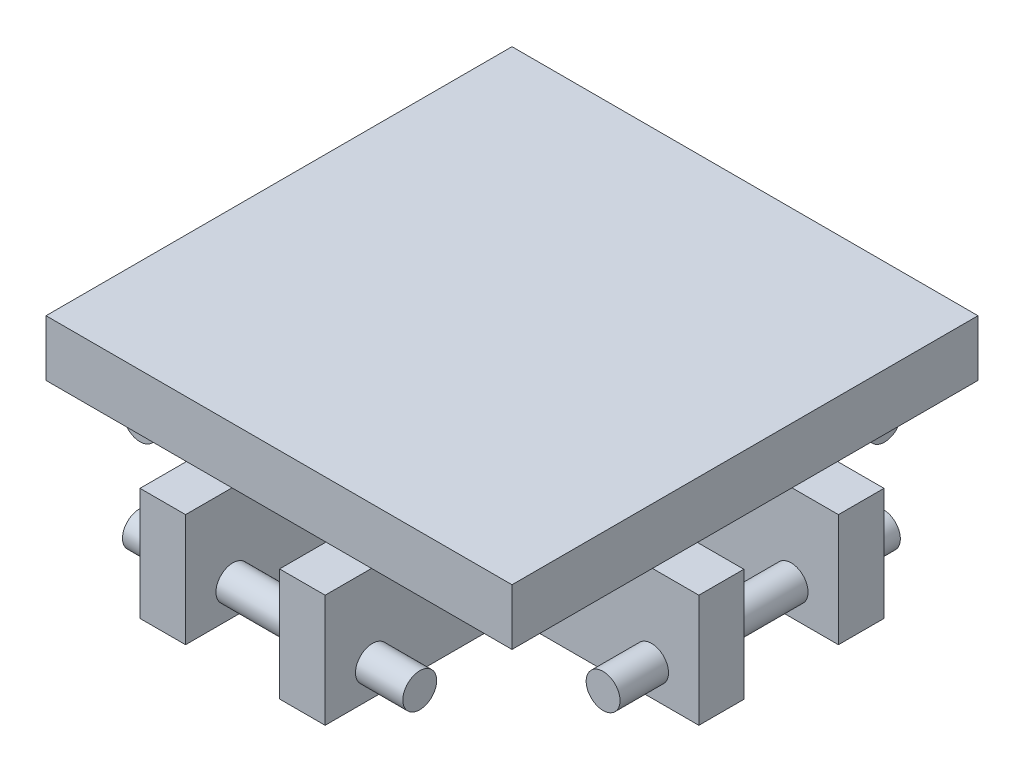
from build123d import *

# Parameters (mm, degrees)
SKETCH1_W                = 79.8
SKETCH1_H                = 79.8
BOSS_EXTRUDE1_DEPTH      = 9.6
SKETCH3_W                = 93.857769302
SKETCH3_H                = 7.7
SKETCH3_W_2              = 31.7
SKETCH3_H_2              = 31.7
SKETCH3_W_3              = 95.7
SKETCH3_H_3              = 7.8
SKETCH3_W_4              = 7.8
SKETCH3_H_4              = 95.7
BOSS_EXTRUDE2_DEPTH      = 19.3
BOSS_EXTRUDE3_DEPTH      = 32
BOSS_EXTRUDE3_DEPTH_BACK = 16
SKETCH4_R                = 2.9
BOSS_EXTRUDE4_DEPTH      = 32
BOSS_EXTRUDE4_DEPTH_BACK = 16
SKETCH5_R                = 2.9
BOSS_EXTRUDE5_DEPTH      = 32
BOSS_EXTRUDE5_DEPTH_BACK = 16
SKETCH6_R                = 2.9
BOSS_EXTRUDE6_DEPTH      = 32
BOSS_EXTRUDE6_DEPTH_BACK = 16
SKETCH7_R                = 2.9


with BuildPart() as part:
    # Sketch1 → Boss-Extrude1 (new body)
    with BuildSketch(Plane(origin=(0, 0, 0), x_dir=(1, 0, 0), z_dir=(0, 1, 0))):
        with Locations((-0.532, -4.965333333)):
            Rectangle(SKETCH1_W, SKETCH1_H)
    extrude(amount=BOSS_EXTRUDE1_DEPTH)

    # Sketch3 → Boss-Extrude2 (add)
    with BuildSketch(Plane.XZ):
        with Locations((0.389115349, 16.965333333)):
            Rectangle(SKETCH3_W, SKETCH3_H)
        with Locations((-0.532, 4.965333333)):
            Rectangle(SKETCH3_W_2, SKETCH3_H_2)
        with Locations((-0.532, -6.984666667)):
            Rectangle(SKETCH3_W_3, SKETCH3_H_3)
        with Locations((-12.482, 4.965333333)):
            Rectangle(SKETCH3_W_4, SKETCH3_H_4)
        with Locations((11.418, 4.965333333)):
            Rectangle(SKETCH3_W_4, SKETCH3_H_4)
    extrude(amount=BOSS_EXTRUDE2_DEPTH)

    # Sketch4 → Boss-Extrude3 (add, two sides: drawn at the far end of the back side and taken through both)
    with BuildSketch(Plane.XY.offset(-3.084666667).offset(-BOSS_EXTRUDE3_DEPTH_BACK)):
        with Locations((-40.282, -14.1)):
            Circle(SKETCH4_R)
    extrude(amount=BOSS_EXTRUDE3_DEPTH + BOSS_EXTRUDE3_DEPTH_BACK)

    # Sketch5 → Boss-Extrude4 (add, two sides: drawn at the far end of the back side and taken through both)
    with BuildSketch(Plane(origin=(-8.582, 0, 0), x_dir=(0, 0, -1), z_dir=(1, 0, 0)).offset(-BOSS_EXTRUDE4_DEPTH_BACK)):
        with Locations((-44.715333333, -14.1)):
            Circle(SKETCH5_R)
    extrude(amount=BOSS_EXTRUDE4_DEPTH + BOSS_EXTRUDE4_DEPTH_BACK)

    # Sketch6 → Boss-Extrude5 (add, two sides: drawn at the far end of the back side and taken through both)
    with BuildSketch(Plane(origin=(0, 0, 13.115333333), x_dir=(-1, 0, 0), z_dir=(0, 0, -1)).offset(-BOSS_EXTRUDE5_DEPTH_BACK)):
        with Locations(Location((-39.218, -14.1, 0), (0, 0, 180))):
            Circle(SKETCH6_R)
    extrude(amount=BOSS_EXTRUDE5_DEPTH + BOSS_EXTRUDE5_DEPTH_BACK)

    # Sketch7 → Boss-Extrude6 (add, two sides: drawn at the far end of the back side and taken through both)
    with BuildSketch(Plane.ZY.offset(-7.518).offset(-BOSS_EXTRUDE6_DEPTH_BACK)):
        with Locations((-34.784666667, -14.1)):
            Circle(SKETCH7_R)
    extrude(amount=BOSS_EXTRUDE6_DEPTH + BOSS_EXTRUDE6_DEPTH_BACK)


solid = part.part
